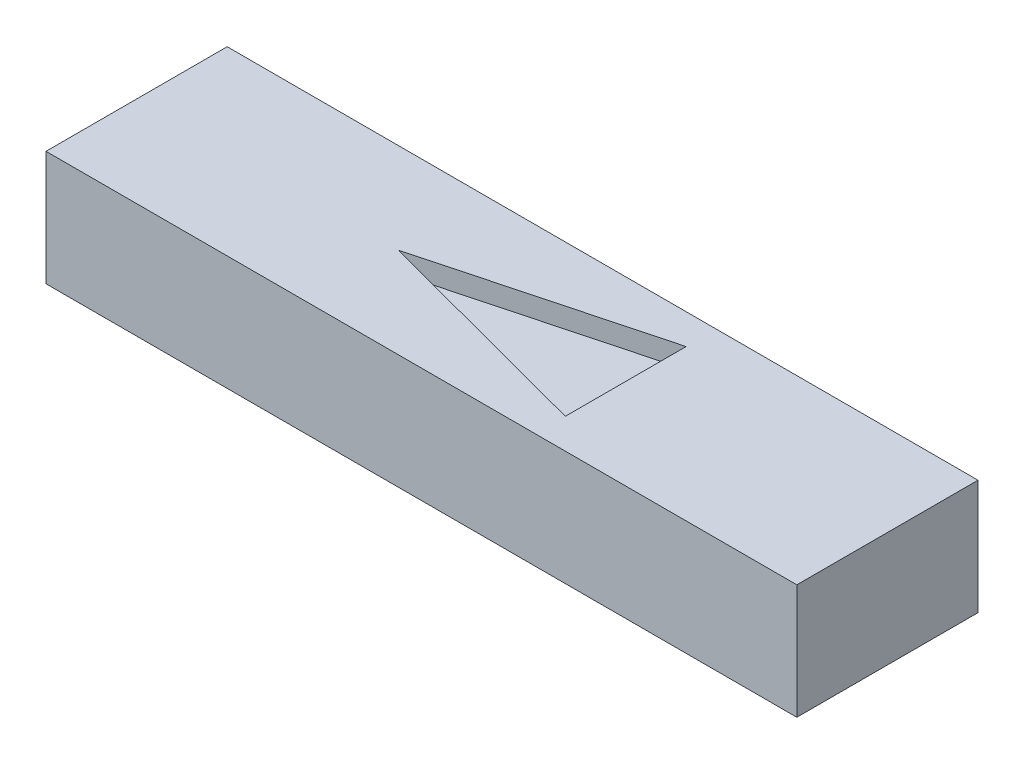
from build123d import *

# Parameters (mm, degrees)
SKETCH2_W           = 37.3
SKETCH2_H           = 9
BOSS_EXTRUDE1_DEPTH = 5.7
CUT_EXTRUDE1_DEPTH  = 1


with BuildPart() as part:
    # Sketch2 → Boss-Extrude1 (new body)
    with BuildSketch(Plane(origin=(0, 0, 0), x_dir=(1, 0, 0), z_dir=(0, 1, 0))):
        with Locations((18.65, 4.5)):
            Rectangle(SKETCH2_W, SKETCH2_H)
    extrude(amount=BOSS_EXTRUDE1_DEPTH)

    # Sketch3 → Cut-Extrude1 (cut)
    with BuildSketch(Plane(origin=(0, 5.7, 0), x_dir=(1, 0, 0), z_dir=(0, 1, 0))):
        Polygon((24.3, 7.5), (13, 4.5), (24.3, 1.5), align=None)
    extrude(amount=-CUT_EXTRUDE1_DEPTH, mode=Mode.SUBTRACT)


solid = part.part
